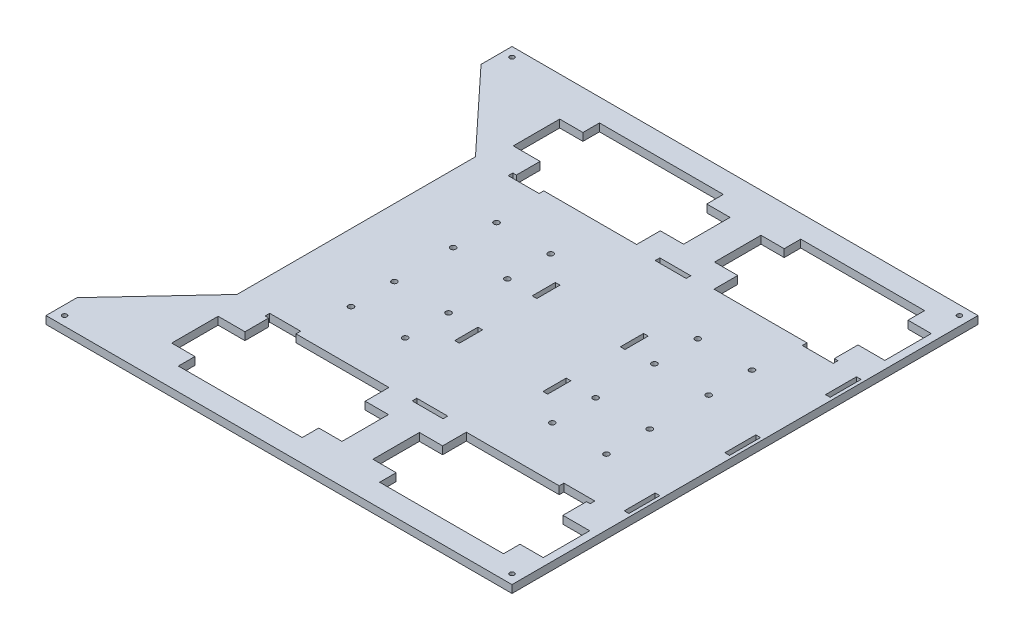
from build123d import *

# Parameters (mm, degrees)
SKETCH1_R           = 1.75
SKETCH1_R_2         = 1.5
SKETCH1_W           = 20
SKETCH1_H           = 3
SKETCH1_W_2         = 3
SKETCH1_H_2         = 15
SKETCH1_H_3         = 20
BOSS_EXTRUDE1_DEPTH = 5


with BuildPart() as part:
    # Sketch1 → Boss-Extrude1 (new body)
    with BuildSketch(Plane(origin=(0, 0, 0), x_dir=(1, 0, 0), z_dir=(0, 1, 0))):
        Polygon((-151, 147.687817745), (150, 147.687817745), (150, -153.312182255), (-151, -153.312182255), (-151, -133.312182255), (-101.110442892, -79.812182255), (-101.110442892, 74.187817745), (-151, 127.687817745), align=None)
        with Locations(Location((-57.5, 44.187817745, 0), (0, 0, 270))):
            Circle(SKETCH1_R, mode=Mode.SUBTRACT)
        with Locations(Location((-22.5, 44.187817745, 0), (0, 0, 270))):
            Circle(SKETCH1_R, mode=Mode.SUBTRACT)
        with Locations(Location((-22.5, 16.187817745, 0), (0, 0, 270))):
            Circle(SKETCH1_R, mode=Mode.SUBTRACT)
        with Locations(Location((-57.5, 16.187817745, 0), (0, 0, 270))):
            Circle(SKETCH1_R, mode=Mode.SUBTRACT)
        with Locations(Location((107.5, 16.187817745, 0), (0, 0, 90))):
            Circle(SKETCH1_R, mode=Mode.SUBTRACT)
        with Locations(Location((72.5, 16.187817745, 0), (0, 0, 90))):
            Circle(SKETCH1_R, mode=Mode.SUBTRACT)
        with Locations(Location((72.5, 44.187817745, 0), (0, 0, 90))):
            Circle(SKETCH1_R, mode=Mode.SUBTRACT)
        with Locations(Location((107.5, 44.187817745, 0), (0, 0, 90))):
            Circle(SKETCH1_R, mode=Mode.SUBTRACT)
        with Locations(Location((107.5, -49.812182255, 0), (0, 0, 270))):
            Circle(SKETCH1_R, mode=Mode.SUBTRACT)
        with Locations(Location((72.5, -49.812182255, 0), (0, 0, 270))):
            Circle(SKETCH1_R, mode=Mode.SUBTRACT)
        with Locations(Location((72.5, -21.812182255, 0), (0, 0, 270))):
            Circle(SKETCH1_R, mode=Mode.SUBTRACT)
        with Locations(Location((107.5, -21.812182255, 0), (0, 0, 270))):
            Circle(SKETCH1_R, mode=Mode.SUBTRACT)
        with Locations(Location((-57.5, -21.812182255, 0), (0, 0, 90))):
            Circle(SKETCH1_R, mode=Mode.SUBTRACT)
        with Locations(Location((-22.5, -21.812182255, 0), (0, 0, 90))):
            Circle(SKETCH1_R, mode=Mode.SUBTRACT)
        with Locations(Location((-22.5, -49.812182255, 0), (0, 0, 90))):
            Circle(SKETCH1_R, mode=Mode.SUBTRACT)
        with Locations(Location((-57.5, -49.812182255, 0), (0, 0, 90))):
            Circle(SKETCH1_R, mode=Mode.SUBTRACT)
        with Locations(Location((144, -147.312182255, 0), (0, 0, 270))):
            Circle(SKETCH1_R_2, mode=Mode.SUBTRACT)
        with Locations(Location((-145, -147.312182255, 0), (0, 0, 270))):
            Circle(SKETCH1_R_2, mode=Mode.SUBTRACT)
        with Locations(Location((144, 141.687817745, 0), (0, 0, 270))):
            Circle(SKETCH1_R_2, mode=Mode.SUBTRACT)
        with Locations(Location((-145, 141.687817745, 0), (0, 0, 270))):
            Circle(SKETCH1_R_2, mode=Mode.SUBTRACT)
        Polygon((35, 122.5), (35, 92.5), (50, 92.5), (50, 77.187817745), (110, 77.187817745), (110, 74.187817745), (130, 74.187817745), (130, 77.187817745), (127.68177751, 77.187817745), (127.68177751, 92.5), (145, 92.5), (145, 122.5), (130, 122.5), (130, 133.187817745), (50, 133.187817745), (50, 122.5), align=None, mode=Mode.SUBTRACT)
        Polygon((-77.68177751, 77.187817745), (-77.68177751, 92.5), (-95, 92.5), (-95, 122.5), (-80, 122.5), (-80, 133.187817745), (0, 133.187817745), (0, 122.5), (15, 122.5), (15, 92.5), (0, 92.5), (0, 77.187817745), (-60, 77.187817745), (-60, 74.187817745), (-80, 74.187817745), (-80, 77.187817745), align=None, mode=Mode.SUBTRACT)
        Polygon((-60, -82.812182255), (-60, -79.812182255), (-80, -79.812182255), (-80, -82.812182255), (-77.68177751, -82.812182255), (-77.68177751, -98.124364509), (-95, -98.124364509), (-95, -128.124364509), (-80, -128.124364509), (-80, -138.812182255), (0, -138.812182255), (0, -128.124364509), (15, -128.124364509), (15, -98.124364509), (0, -98.124364509), (0, -82.812182255), align=None, mode=Mode.SUBTRACT)
        with Locations((25, -81.312182255)):
            Rectangle(SKETCH1_W, SKETCH1_H, mode=Mode.SUBTRACT)
        Polygon((130, -79.812182255), (130, -82.812182255), (127.68177751, -82.812182255), (127.68177751, -98.124364509), (145, -98.124364509), (145, -128.124364509), (130, -128.124364509), (130, -138.812182255), (50, -138.812182255), (50, -128.124364509), (35, -128.124364509), (35, -98.124364509), (50, -98.124364509), (50, -82.812182255), (110, -82.812182255), (110, -79.812182255), align=None, mode=Mode.SUBTRACT)
        with Locations((25, 75.687817745)):
            Rectangle(SKETCH1_W, SKETCH1_H, mode=Mode.SUBTRACT)
        with Locations((-3.5, 22.187817745)):
            Rectangle(SKETCH1_W_2, SKETCH1_H_2, mode=Mode.SUBTRACT)
        with Locations((-3.5, -27.812182255)):
            Rectangle(SKETCH1_W_2, SKETCH1_H_2, mode=Mode.SUBTRACT)
        with Locations((53.5, -27.812182255)):
            Rectangle(SKETCH1_W_2, SKETCH1_H_2, mode=Mode.SUBTRACT)
        with Locations((53.5, 22.187817745)):
            Rectangle(SKETCH1_W_2, SKETCH1_H_2, mode=Mode.SUBTRACT)
        with Locations((146.5, 64.187817745)):
            Rectangle(SKETCH1_W_2, SKETCH1_H_3, mode=Mode.SUBTRACT)
        with Locations((146.5, -0.812182255)):
            Rectangle(SKETCH1_W_2, SKETCH1_H_3, mode=Mode.SUBTRACT)
        with Locations((146.5, -65.812182255)):
            Rectangle(SKETCH1_W_2, SKETCH1_H_3, mode=Mode.SUBTRACT)
    extrude(amount=BOSS_EXTRUDE1_DEPTH)


solid = part.part
